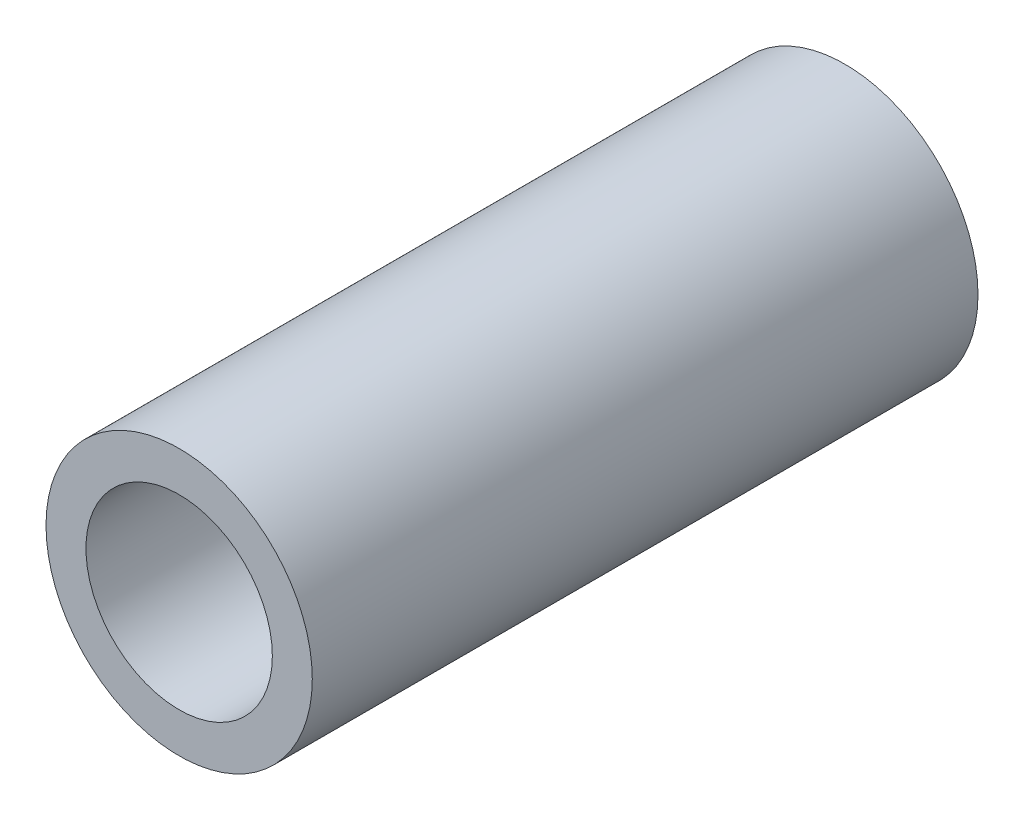
from build123d import *

# Parameters (mm, degrees)
SKETCH_1_R      = 2
SKETCH_1_R_2    = 1.4
EXTRUDE_1_DEPTH = 10


with BuildPart() as part:
    # 草图1 → 凸台-拉伸1 (new body)
    with BuildSketch(Plane.XY):
        Circle(SKETCH_1_R)
        Circle(SKETCH_1_R_2, mode=Mode.SUBTRACT)
    extrude(amount=EXTRUDE_1_DEPTH)


solid = part.part
